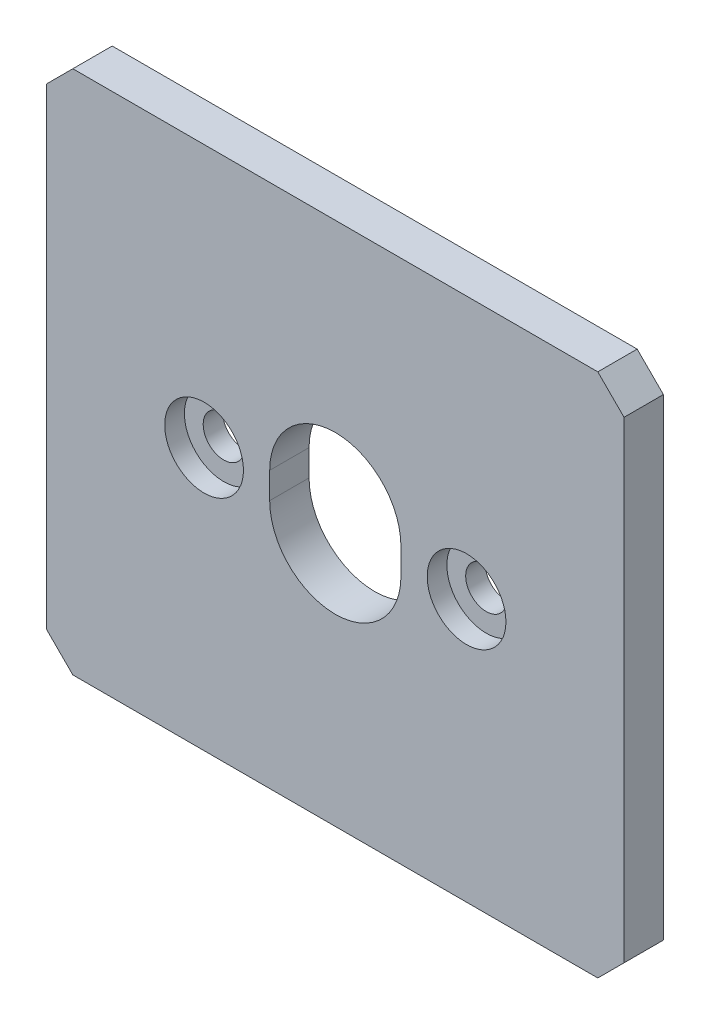
from build123d import *

# Parameters (mm, degrees)
SKETCH1_W           = 69.85
SKETCH1_H           = 63.5
SKETCH1_R           = 2.4892
BOSS_EXTRUDE1_DEPTH = 4.7625
CHAMFER1_SIZE       = 3.175
SKETCH2_R           = 4.7625
CUT_EXTRUDE1_DEPTH  = 2.38125


with BuildPart() as part:
    # Sketch1 → Boss-Extrude1 (new body)
    with BuildSketch(Plane.XY):
        Rectangle(SKETCH1_W, SKETCH1_H)
        with Locations(Location((-15.875, 0, 0), (0, 0, 180))):
            Circle(SKETCH1_R, mode=Mode.SUBTRACT)
        with Locations(Location((15.875, 0, 0), (0, 0, 180))):
            Circle(SKETCH1_R, mode=Mode.SUBTRACT)
        with BuildLine():
            Line((7.9375, 1.5875), (7.9375, -1.5875))
            ThreePointArc((7.9375, -1.5875), (0, -9.525), (-7.9375, -1.5875))
            Line((-7.9375, -1.5875), (-7.9375, 1.5875))
            ThreePointArc((-7.9375, 1.5875), (0, 9.525), (7.9375, 1.5875))
        make_face(mode=Mode.SUBTRACT)
    extrude(amount=BOSS_EXTRUDE1_DEPTH)

    # Chamfer1
    chamfer1_edges = [part.edges().sort_by_distance(p)[0] for p in [
        (34.925, -31.75, 2.38125),
        (-34.925, -31.75, 2.38125),
        (-34.925, 31.75, 2.38125),
        (34.925, 31.75, 2.38125),
    ]]
    chamfer(chamfer1_edges, length=CHAMFER1_SIZE)

    # Sketch2 → Cut-Extrude1 (cut)
    with BuildSketch(Plane.XY.offset(4.7625)):
        with Locations((-15.875, 0)):
            Circle(SKETCH2_R)
        with Locations((15.875, 0)):
            Circle(SKETCH2_R)
    extrude(amount=-CUT_EXTRUDE1_DEPTH, mode=Mode.SUBTRACT)


solid = part.part
